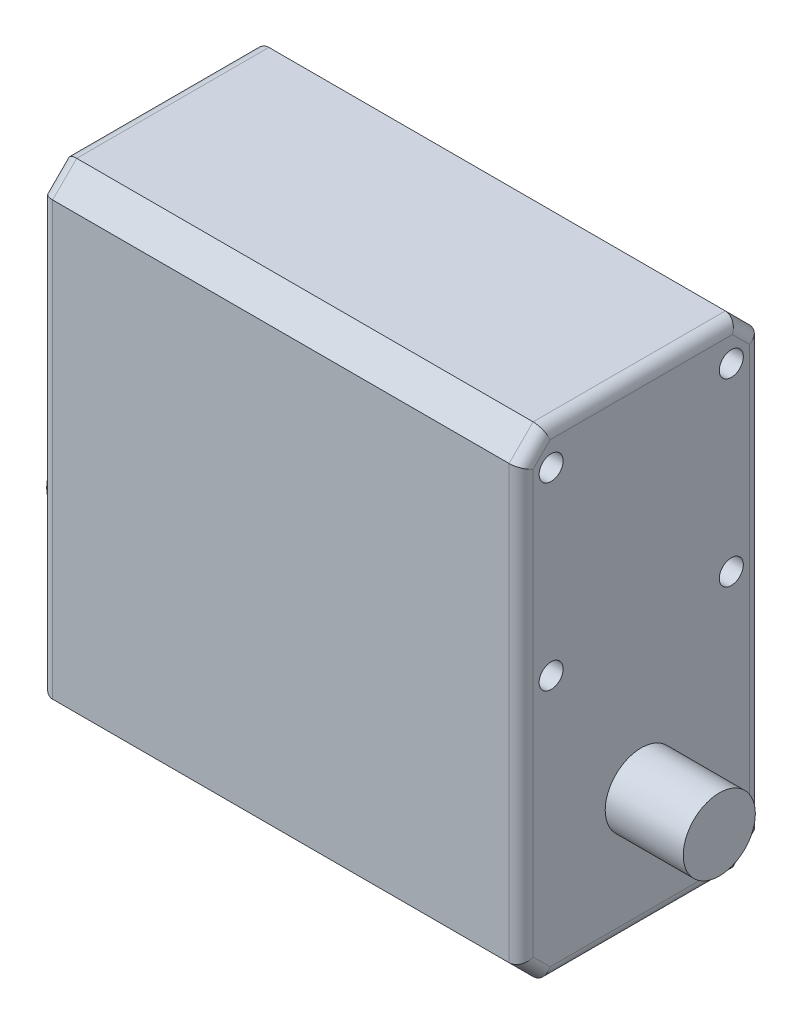
from build123d import *

# Parameters (mm, degrees)
SKETCH_1_W           = 20
SKETCH_1_H           = 40
EXTRUDE_1_DEPTH      = 40
SKETCH_2_R           = 1
CUT_EXTRUDE_3_DEPTH  = 40
EXTRUDE_2_DEPTH      = 5
EXTRUDE_2_DEPTH_BACK = 45
SKETCH_4_R           = 1.5
CHAMFER_1_SIZE       = 2
FILLET_1_R           = 1
SKETCH_5_R           = 3
EXTRUDE_3_DEPTH      = 50
EXTRUDE_4_DEPTH      = 1.5
EXTRUDE_4_DEPTH_BACK = 53
SKETCH_7_R           = 3
SKETCH_12_W          = 1.5
SKETCH_12_H          = 6.856105301
CUT_EXTRUDE_6_DEPTH  = 25.5
EXTRUDE_START        = 6.5
SKETCH_9_R           = 3
EXTRUDE_7_DEPTH      = 6.5


with BuildPart() as part:
    # ｽｹｯﾁ1 → ﾎﾞｽ - 押し出し1 (new body)
    with BuildSketch(Plane(origin=(0, 0, 0), x_dir=(0, 0, -1), z_dir=(1, 0, 0))):
        with Locations((-16.51810585, 9.247910864)):
            Rectangle(SKETCH_1_W, SKETCH_1_H)
    extrude(amount=EXTRUDE_1_DEPTH)

    # ｽｹｯﾁ2 → ｶｯﾄ - 押し出し3 (cut)
    with BuildSketch(Plane.ZY):
        with Locations((9.01810585, 26.201539891)):
            Circle(SKETCH_2_R)
        with Locations((9.01810585, 11.201539891)):
            Circle(SKETCH_2_R)
        with Locations((24.01810585, 11.201539891)):
            Circle(SKETCH_2_R)
        with Locations(Location((24.01810585, 26.201539891, 0), (0, 0, 180))):
            Circle(SKETCH_2_R)
    extrude(amount=-CUT_EXTRUDE_3_DEPTH, mode=Mode.SUBTRACT)

    # ｽｹｯﾁ4 → ﾎﾞｽ - 押し出し2 (add, two sides: drawn at the far end of the back side and taken through both)
    with BuildSketch(Plane.ZY.offset(-EXTRUDE_2_DEPTH_BACK)):
        with Locations((16.51810585, -0.752089136)):
            Circle(SKETCH_4_R)
    extrude(amount=EXTRUDE_2_DEPTH + EXTRUDE_2_DEPTH_BACK)

    # 面取り1
    chamfer_1_edges = [part.edges().sort_by_distance(p)[0] for p in [
        (20, -10.752089136, 6.51810585),
        (20, -10.752089136, 26.51810585),
        (20, 29.247910864, 26.51810585),
        (20, 29.247910864, 6.51810585),
    ]]
    chamfer(chamfer_1_edges, length=CHAMFER_1_SIZE)

    # ﾌｨﾚｯﾄ1
    fillet_1_edges = [part.edges().sort_by_distance(p)[0] for p in [
        (0, 9.247910864, 26.51810585),
        (40, 9.247910864, 26.51810585),
        (0, 9.247910864, 6.51810585),
        (0, -10.752089136, 16.51810585),
        (0, 29.247910864, 16.51810585),
        (0, -9.752089136, 25.51810585),
        (0, -9.752089136, 7.51810585),
        (0, 28.247910864, 7.51810585),
        (0, 28.247910864, 25.51810585),
        (40, 29.247910864, 16.51810585),
        (40, 9.247910864, 6.51810585),
        (40, -10.752089136, 16.51810585),
        (40, -9.752089136, 25.51810585),
        (40, -9.752089136, 7.51810585),
        (40, 28.247910864, 7.51810585),
        (40, 28.247910864, 25.51810585),
    ]]
    fillet(fillet_1_edges, radius=FILLET_1_R)

    # ｽｹｯﾁ5 → ﾎﾞｽ - 押し出し3 (add)
    with BuildSketch(Plane.ZY.offset(5)):
        with Locations((16.51810585, -0.752089136)):
            Circle(SKETCH_5_R)
    extrude(amount=-EXTRUDE_3_DEPTH)

    # ｽｹｯﾁ7 → ﾎﾞｽ - 押し出し4 (add, two sides: drawn at the far end of the back side and taken through both)
    with BuildSketch(Plane.ZY.offset(5).offset(-EXTRUDE_4_DEPTH_BACK)):
        with Locations((16.51810585, -0.752089136)):
            Circle(SKETCH_7_R)
    extrude(amount=EXTRUDE_4_DEPTH + EXTRUDE_4_DEPTH_BACK)

    # ｽｹｯﾁ12 → ｶｯﾄ - 押し出し6 (cut)
    with BuildSketch(Plane.XY):
        with Locations((47.25, -0.324036486)):
            Rectangle(SKETCH_12_W, SKETCH_12_H)
    extrude(amount=CUT_EXTRUDE_6_DEPTH, mode=Mode.SUBTRACT)

    # ｽｹｯﾁ9 → ﾎﾞｽ - 押し出し7 (add)
    with BuildSketch(Plane.ZY.offset(EXTRUDE_START)):
        with Locations((16.51810585, -0.752089136)):
            Circle(SKETCH_9_R)
    extrude(amount=-EXTRUDE_7_DEPTH)


solid = part.part
